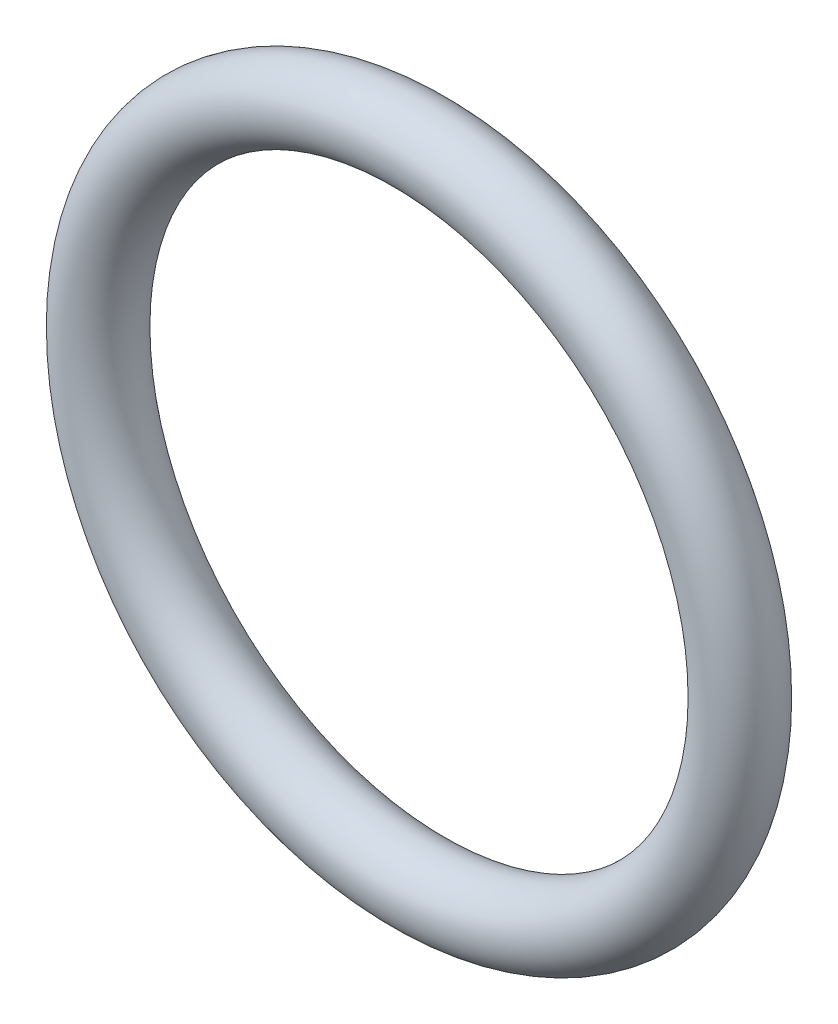
from build123d import *

# Parameters (mm, degrees)
SKETCH1_R = 1.3081


with BuildPart() as part:
    # Sketch1 → Revolve1 (revolve)
    with BuildSketch(Plane(origin=(0, 0, 0), x_dir=(0, -1, 0), z_dir=(1, 0, 0)), mode=Mode.PRIVATE) as revolve1_sk:
        with Locations((11.4554, 0)):
            Circle(SKETCH1_R)
    revolve(revolve1_sk.sketch.rotate(Axis((0, 0, 1.3081), (0, 0, -1)), 270), axis=Axis((0, 0, 1.3081), (0, 0, -1)))


solid = part.part
